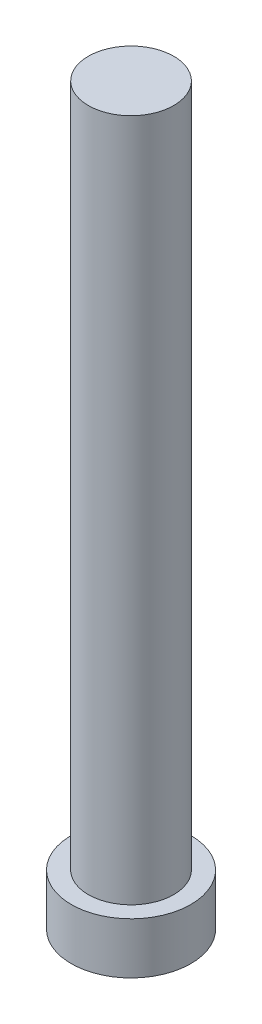
from build123d import *

# Parameters (mm, degrees)
SKETCH2_R           = 2.5
BOSS_EXTRUDE2_DEPTH = 40
SKETCH3_R           = 3.5
BOSS_EXTRUDE3_DEPTH = 3


with BuildPart() as part:
    # Sketch2 → Boss-Extrude2 (new body)
    with BuildSketch(Plane(origin=(0, 0, 0), x_dir=(1, 0, 0), z_dir=(0, 1, 0))):
        with Locations(Location((0, 0, 0), (0, 0, 270))):
            Circle(SKETCH2_R)
    extrude(amount=BOSS_EXTRUDE2_DEPTH)

    # Sketch3 → Boss-Extrude3 (add)
    with BuildSketch(Plane(origin=(0, 0, 0), x_dir=(-1, 0, 0), z_dir=(0, -1, 0))):
        with Locations(Location((0, 0, 0), (0, 0, 90))):
            Circle(SKETCH3_R)
    extrude(amount=BOSS_EXTRUDE3_DEPTH)


solid = part.part
